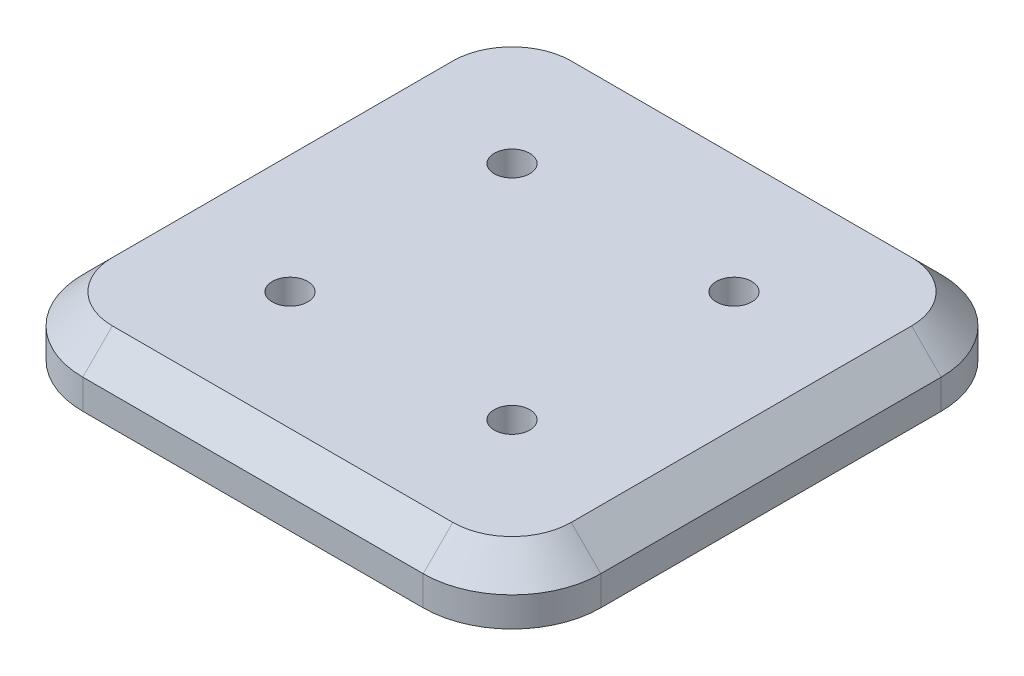
from build123d import *

# Parameters (mm, degrees)
SKETCH_1_W                 = 175
SKETCH_1_H                 = 175
EXTRUDE_1_DEPTH            = 20
FILLET_1_R                 = 30
CHAMFER_1_SIZE             = 10
F_20_0MM_1_D               = 12
F_20_0MM_1_DEPTH           = 10
F_20_0MM_1_TIP             = 3.605163714
F_20_0MM_1_ON_FACE_2_D     = 12
F_20_0MM_1_ON_FACE_2_DEPTH = 10
F_20_0MM_1_ON_FACE_2_TIP   = 3.605163714


with BuildPart() as part:
    # 草圖1 → 填料-伸長1 (new body)
    with BuildSketch(Plane(origin=(0, 0, 0), x_dir=(1, 0, 0), z_dir=(0, 1, 0))):
        with Locations((87.5, 87.5)):
            Rectangle(SKETCH_1_W, SKETCH_1_H)
    extrude(amount=EXTRUDE_1_DEPTH)

    # 圓角1
    fillet_1_edges = [part.edges().sort_by_distance(p)[0] for p in [
        (0, 10, -175),
        (175, 10, -175),
        (175, 10, 0),
        (0, 10, 0),
    ]]
    fillet(fillet_1_edges, radius=FILLET_1_R)

    # 導角1
    chamfer_1_edges = [part.edges().sort_by_distance(p)[0] for p in [
        (0, 20, -87.5),
        (87.5, 20, -175),
        (87.5, 20, 0),
        (175, 20, -87.5),
        (8.786796564, 20, -8.786796564),
        (166.213203436, 20, -8.786796564),
        (166.213203436, 20, -166.213203436),
        (8.786796564, 20, -166.213203436),
    ]]
    chamfer(chamfer_1_edges, length=CHAMFER_1_SIZE)

    # Ø20.0mm 定位孔1
    with Locations(Plane(origin=(50, 20, -50), x_dir=(0, 0, 1), z_dir=(0, 1, 0))):
        with Locations((0, 0), (-75, 0), (-75, 75), (0, 75)):
            Hole(F_20_0MM_1_D / 2, depth=F_20_0MM_1_DEPTH)
            with Locations((0, 0, -(F_20_0MM_1_DEPTH + F_20_0MM_1_TIP / 2))):  # 118° drill point
                Cone(0, F_20_0MM_1_D / 2, F_20_0MM_1_TIP, mode=Mode.SUBTRACT)

    # Ø20.0mm 定位孔1 on face 2
    with Locations(Plane(origin=(25, 0, -25), x_dir=(0, 0, -1), z_dir=(0, -1, 0))):
        with Locations((0, 0), (0, 125), (125, 125), (125, 0)):
            Hole(F_20_0MM_1_ON_FACE_2_D / 2, depth=F_20_0MM_1_ON_FACE_2_DEPTH)
            with Locations((0, 0, -(F_20_0MM_1_ON_FACE_2_DEPTH + F_20_0MM_1_ON_FACE_2_TIP / 2))):  # 118° drill point
                Cone(0, F_20_0MM_1_ON_FACE_2_D / 2, F_20_0MM_1_ON_FACE_2_TIP, mode=Mode.SUBTRACT)


solid = part.part
